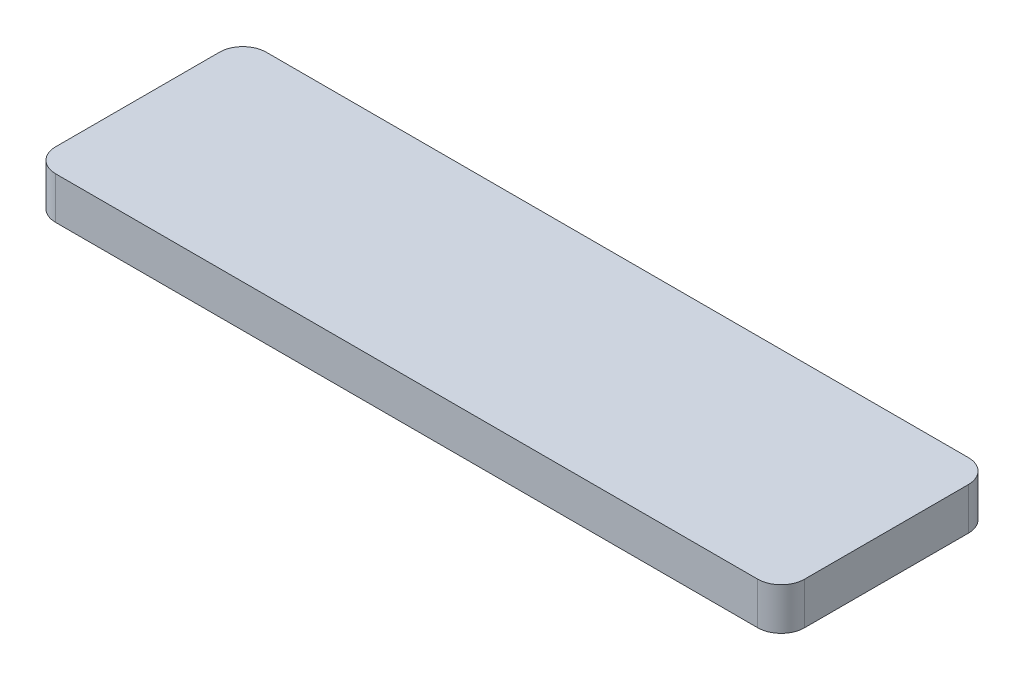
from build123d import *

# Parameters (mm, degrees)
SKETCH_1_W      = 320
SKETCH_1_H      = 90
EXTRUDE_1_DEPTH = 18
FILLET_1_R      = 10


with BuildPart() as part:
    # 草图1 → 凸台-拉伸1 (new body)
    with BuildSketch(Plane(origin=(0, 0, 0), x_dir=(1, 0, 0), z_dir=(0, 1, 0))):
        Rectangle(SKETCH_1_W, SKETCH_1_H)
    extrude(amount=EXTRUDE_1_DEPTH)

    # 圆角1
    fillet_1_edges = [part.edges().sort_by_distance(p)[0] for p in [
        (-160, 9, -45),
        (160, 9, -45),
        (160, 9, 45),
        (-160, 9, 45),
    ]]
    fillet(fillet_1_edges, radius=FILLET_1_R)


solid = part.part
